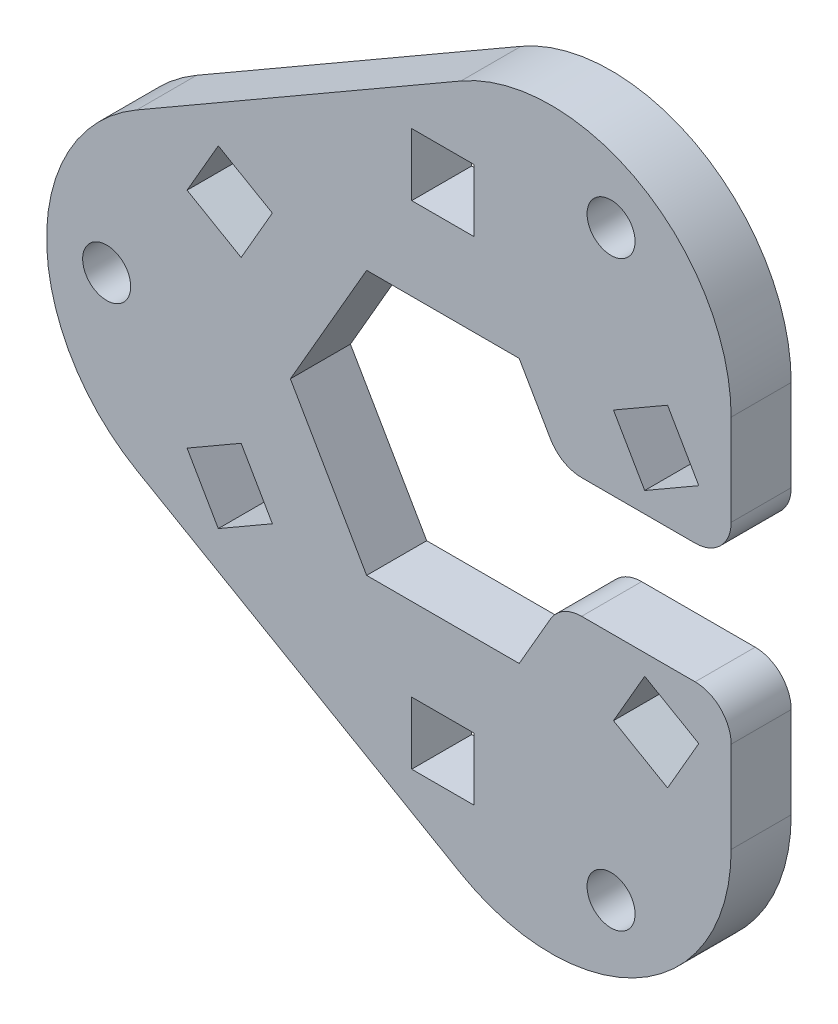
from build123d import *

# Parameters (mm, degrees)
SKETCH1_R           = 2
SKETCH1_W           = 5.2
SKETCH1_H           = 5.2
BOSS_EXTRUDE1_DEPTH = 5
CONG_1_R            = 15
CONG_2_R            = 3


with BuildPart() as part:
    # Sketch1 → Boss-Extrude1 (new body)
    with BuildSketch(Plane.XY):
        Polygon((24, 5), (9.814954576, 5), (6.350852961, 11), (-6.350852961, 11), (-12.701705922, 0), (-6.350852961, -11), (6.350852961, -11), (9.814954576, -5), (24, -5), (24, -41.569219382), (-48, 0), (24, 41.569219382), align=None)
        with Locations((14, 24.248711306)):
            Circle(SKETCH1_R, mode=Mode.SUBTRACT)
        with Locations((14, -24.248711306)):
            Circle(SKETCH1_R, mode=Mode.SUBTRACT)
        with Locations((-28, 0)):
            Circle(SKETCH1_R, mode=Mode.SUBTRACT)
        with Locations((0, 20.5)):
            Rectangle(SKETCH1_W, SKETCH1_H, mode=Mode.SUBTRACT)
        Polygon((21.305186827, 9.29833395), (16.801854728, 6.69833395), (14.201854728, 11.20166605), (18.705186827, 13.80166605), align=None, mode=Mode.SUBTRACT)
        Polygon((18.705186827, -13.80166605), (14.201854728, -11.20166605), (16.801854728, -6.69833395), (21.305186827, -9.29833395), align=None, mode=Mode.SUBTRACT)
        with Locations((0, -20.5)):
            Rectangle(SKETCH1_W, SKETCH1_H, mode=Mode.SUBTRACT)
        Polygon((-21.305186827, -9.29833395), (-16.801854728, -6.69833395), (-14.201854728, -11.20166605), (-18.705186827, -13.80166605), align=None, mode=Mode.SUBTRACT)
        Polygon((-18.705186827, 13.80166605), (-14.201854728, 11.20166605), (-16.801854728, 6.69833395), (-21.305186827, 9.29833395), align=None, mode=Mode.SUBTRACT)
    extrude(amount=BOSS_EXTRUDE1_DEPTH)

    # Congé1
    cong_1_edges = [part.edges().sort_by_distance(p)[0] for p in [
        (24, -41.569219382, 2.5),
        (-48, 0, 2.5),
        (24, 41.569219382, 2.5),
    ]]
    fillet(cong_1_edges, radius=CONG_1_R)

    # Congé2
    cong_2_edges = [part.edges().sort_by_distance(p)[0] for p in [
        (24, 5, 2.5),
        (9.814954576, 5, 2.5),
        (9.814954576, -5, 2.5),
        (24, -5, 2.5),
    ]]
    fillet(cong_2_edges, radius=CONG_2_R)


solid = part.part
